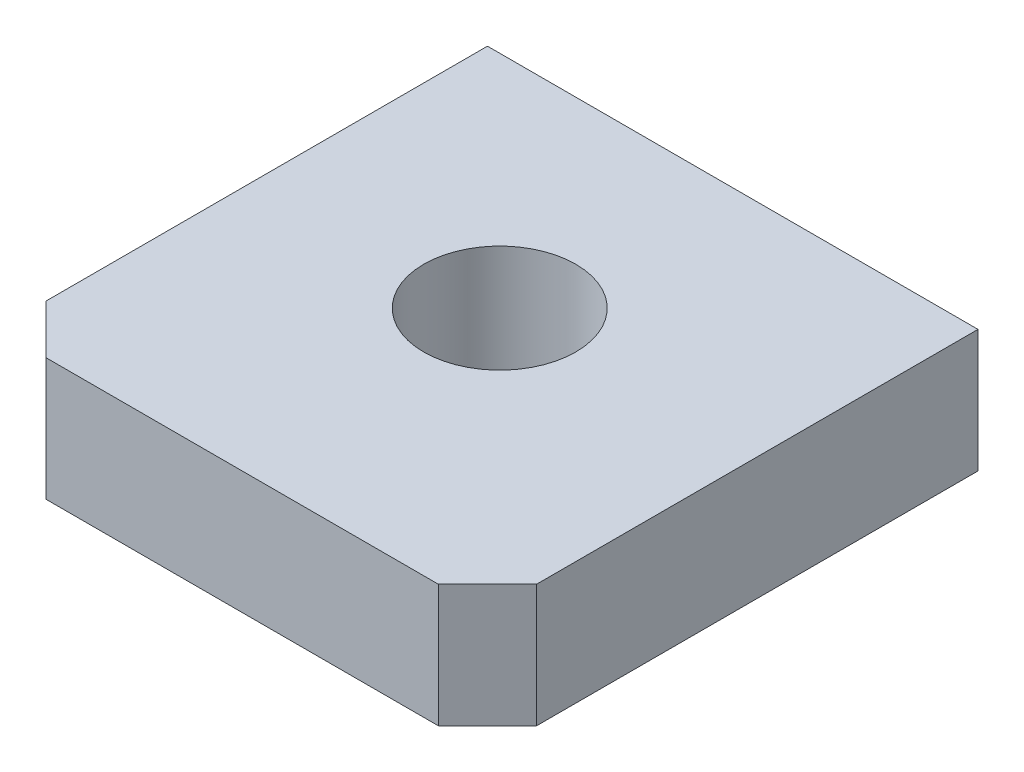
from build123d import *

# Parameters (mm, degrees)
SKETCH_1_W          = 20
SKETCH_1_H          = 20
EXTRUDE_1_DEPTH     = 5
SKETCH_2_R          = 3.1
CUT_EXTRUDE_1_DEPTH = 5
CHAMFER_1_SIZE      = 2


with BuildPart() as part:
    # 스케치1 → 보스-돌출1 (new body)
    with BuildSketch(Plane(origin=(0, 0, 0), x_dir=(1, 0, 0), z_dir=(0, 1, 0))):
        with Locations((10, 10)):
            Rectangle(SKETCH_1_W, SKETCH_1_H)
    extrude(amount=EXTRUDE_1_DEPTH)

    # 스케치2 → 컷-돌출1 (cut)
    with BuildSketch(Plane(origin=(0, 5, 0), x_dir=(1, 0, 0), z_dir=(0, 1, 0))):
        with Locations(Location((9.5, 11, 0), (0, 0, 270))):
            Circle(SKETCH_2_R)
    extrude(amount=-CUT_EXTRUDE_1_DEPTH, mode=Mode.SUBTRACT)

    # 모따기1
    chamfer_1_edges = [part.edges().sort_by_distance(p)[0] for p in [
        (20, 2.5, 0),
        (0, 2.5, 0),
    ]]
    chamfer(chamfer_1_edges, length=CHAMFER_1_SIZE)


solid = part.part
